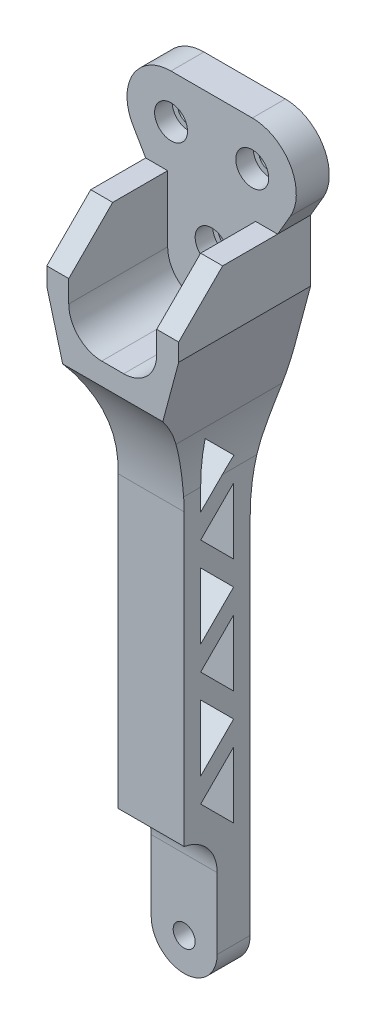
from build123d import *

# Parameters (mm, degrees)
BOSS_EXTRUDE1_DEPTH                     = 40
CUT_EXTRUDE3_REACH                      = 349.563
SKETCH2_W                               = 10
SKETCH2_H                               = 8
FILLET1_RADIUS                          = 15
FILLET1_LENGTH                          = 15
SKETCH3_R                               = 5
CUT_EXTRUDE4_DEPTH                      = 15
CUT_EXTRUDE5_REACH                      = 349.394
CBORE_FOR_M5_HEX_HEAD_BOLT1_D           = 10
CBORE_FOR_M5_HEX_HEAD_BOLT1_CBORE_D     = 15
CBORE_FOR_M5_HEX_HEAD_BOLT1_CBORE_DEPTH = 8
CUT_EXTRUDE6_DEPTH                      = 40


with BuildPart() as part:
    # Sketch1 → Boss-Extrude1 (new, symmetric)
    with BuildSketch(Plane.YZ):
        with BuildLine():
            Line((0, 0), (47.251760651, 0))
            ThreePointArc((47.251760651, 0), (58.870710689, 4.252272915), (65, 15))
            Line((65, 15), (196.846599289, 15))
            ThreePointArc((196.846599289, 15), (222.463976204, 19.510639101), (245, 32.5))
            Line((245, 32.5), (280, 32.5))
            Line((280, 32.5), (300, 12.5))
            Line((300, 12.5), (300, -12.5))
            Line((300, -12.5), (340, -12.5))
            Line((340, -12.5), (340, -27.5))
            Line((340, -27.5), (245, -27.5))
            add(Edge.make_bspline(
                [(179, -15), (212.333333333, -15), (211.666666667, -27.5), (245, -27.5)],
                knots=[0, 0, 0, 0, 1, 1, 1, 1], degree=3))
            Line((179, -15), (0, -15))
            Line((0, -15), (0, 0))
        make_face()
    extrude(amount=BOSS_EXTRUDE1_DEPTH, both=True)

    # Cut-Extrude3: up to this face of the body (flat: up to its plane)
    cut_extrude3_end = Plane(part.part.faces().sort_by_distance((0, 292.5, -27.5))[0])
    # Sketch2 → Cut-Extrude3 (cut, up to the picked face)
    with BuildSketch(Plane.XY.offset(32.5), mode=Mode.PRIVATE) as cut_extrude3_sk1:
        with BuildLine():
            Line((15, 202.853988128), (15, 0))
            Line((15, 0), (40, 0))
            Line((40, 0), (40, 47.251760651))
            Line((40, 47.251760651), (40, 245))
            Line((40, 245), (22.765371804, 245))
            Line((22.765371804, 245), (18.407417371, 228.735892638))
            ThreePointArc((18.407417371, 228.735892638), (15.855513863, 215.90660735), (15, 202.853988128))
        make_face()
    cut_extrude3_tool1 = split(extrude(cut_extrude3_sk1.sketch, amount=-CUT_EXTRUDE3_REACH, mode=Mode.PRIVATE), bisect_by=cut_extrude3_end, keep=Keep.BOTH, mode=Mode.PRIVATE)
    # Sketch2 → Cut-Extrude3 (cut, up to the picked face)
    with BuildSketch(Plane.XY.offset(32.5), mode=Mode.PRIVATE) as cut_extrude3_sk2:
        with BuildLine():
            Line((-40, 0), (-15, 0))
            Line((-15, 0), (-15, 202.853988128))
            ThreePointArc((-15, 202.853988128), (-15.855513863, 215.90660735), (-18.407417371, 228.735892638))
            Line((-18.407417371, 228.735892638), (-22.765371804, 245))
            Line((-22.765371804, 245), (-40, 245))
            Line((-40, 245), (-40, 0))
        make_face()
    cut_extrude3_tool2 = split(extrude(cut_extrude3_sk2.sketch, amount=-CUT_EXTRUDE3_REACH, mode=Mode.PRIVATE), bisect_by=cut_extrude3_end, keep=Keep.BOTH, mode=Mode.PRIVATE)
    # Sketch2 → Cut-Extrude3 (cut, up to the picked face)
    with BuildSketch(Plane.XY.offset(32.5), mode=Mode.PRIVATE) as cut_extrude3_sk3:
        Polygon((30, 272), (22.765371804, 245), (40, 245), (40, 272), align=None)
    cut_extrude3_tool3 = split(extrude(cut_extrude3_sk3.sketch, amount=-CUT_EXTRUDE3_REACH, mode=Mode.PRIVATE), bisect_by=cut_extrude3_end, keep=Keep.BOTH, mode=Mode.PRIVATE)
    # Sketch2 → Cut-Extrude3 (cut, up to the picked face)
    with BuildSketch(Plane.XY.offset(32.5), mode=Mode.PRIVATE) as cut_extrude3_sk4:
        Polygon((-40, 272), (-40, 245), (-22.765371804, 245), (-30, 272), align=None)
    cut_extrude3_tool4 = split(extrude(cut_extrude3_sk4.sketch, amount=-CUT_EXTRUDE3_REACH, mode=Mode.PRIVATE), bisect_by=cut_extrude3_end, keep=Keep.BOTH, mode=Mode.PRIVATE)
    # Sketch2 → Cut-Extrude3 (cut, up to the picked face)
    with BuildSketch(Plane.XY.offset(32.5), mode=Mode.PRIVATE) as cut_extrude3_sk5:
        with BuildLine():
            Line((30, 300), (30, 280))
            Line((30, 280), (40, 280))
            Line((40, 280), (40, 340))
            Line((40, 340), (18.5, 340))
            ThreePointArc((18.5, 340), (35.838126061, 329.969422485), (35.78511038, 309.938938469))
            Line((35.78511038, 309.938938469), (35.773706219, 309.919345885))
            Line((35.773706219, 309.919345885), (30, 300))
        make_face()
    cut_extrude3_tool5 = split(extrude(cut_extrude3_sk5.sketch, amount=-CUT_EXTRUDE3_REACH, mode=Mode.PRIVATE), bisect_by=cut_extrude3_end, keep=Keep.BOTH, mode=Mode.PRIVATE)
    # Sketch2 → Cut-Extrude3 (cut, up to the picked face)
    with BuildSketch(Plane.XY.offset(32.5), mode=Mode.PRIVATE) as cut_extrude3_sk6:
        with Locations((35, 276)):
            Rectangle(SKETCH2_W, SKETCH2_H)
    cut_extrude3_tool6 = split(extrude(cut_extrude3_sk6.sketch, amount=-CUT_EXTRUDE3_REACH, mode=Mode.PRIVATE), bisect_by=cut_extrude3_end, keep=Keep.BOTH, mode=Mode.PRIVATE)
    # Sketch2 → Cut-Extrude3 (cut, up to the picked face)
    with BuildSketch(Plane.XY.offset(32.5), mode=Mode.PRIVATE) as cut_extrude3_sk7:
        with Locations((-35, 276)):
            Rectangle(SKETCH2_W, SKETCH2_H)
    cut_extrude3_tool7 = split(extrude(cut_extrude3_sk7.sketch, amount=-CUT_EXTRUDE3_REACH, mode=Mode.PRIVATE), bisect_by=cut_extrude3_end, keep=Keep.BOTH, mode=Mode.PRIVATE)
    # Sketch2 → Cut-Extrude3 (cut, up to the picked face)
    with BuildSketch(Plane.XY.offset(32.5), mode=Mode.PRIVATE) as cut_extrude3_sk8:
        with BuildLine():
            Line((-40, 340), (-40, 280))
            Line((-40, 280), (-30, 280))
            Line((-30, 280), (-30, 300))
            Line((-30, 300), (-35.773706219, 309.919345885))
            Line((-35.773706219, 309.919345885), (-35.78511038, 309.938938469))
            ThreePointArc((-35.78511038, 309.938938469), (-35.838126061, 329.969422485), (-18.5, 340))
            Line((-18.5, 340), (-40, 340))
        make_face()
    cut_extrude3_tool8 = split(extrude(cut_extrude3_sk8.sketch, amount=-CUT_EXTRUDE3_REACH, mode=Mode.PRIVATE), bisect_by=cut_extrude3_end, keep=Keep.BOTH, mode=Mode.PRIVATE)
    add(cut_extrude3_tool1.solids().sort_by(Axis((27.70054, 120.268436, 32.5), (0, 0, -1)))[0], mode=Mode.SUBTRACT)
    add(cut_extrude3_tool2.solids().sort_by(Axis((-27.70054, 120.268436, 32.5), (0, 0, -1)))[0], mode=Mode.SUBTRACT)
    add(cut_extrude3_tool3.solids().sort_by(Axis((33.031192, 257.304616, 32.5), (0, 0, -1)))[0], mode=Mode.SUBTRACT)
    add(cut_extrude3_tool4.solids().sort_by(Axis((-33.031192, 257.304616, 32.5), (0, 0, -1)))[0], mode=Mode.SUBTRACT)
    add(cut_extrude3_tool5.solids().sort_by(Axis((35.537859, 306.308968, 32.5), (0, 0, -1)))[0], mode=Mode.SUBTRACT)
    add(cut_extrude3_tool6.solids().sort_by(Axis((35, 276, 32.5), (0, 0, -1)))[0], mode=Mode.SUBTRACT)
    add(cut_extrude3_tool7.solids().sort_by(Axis((-35, 276, 32.5), (0, 0, -1)))[0], mode=Mode.SUBTRACT)
    add(cut_extrude3_tool8.solids().sort_by(Axis((-35.537859, 306.308968, 32.5), (0, 0, -1)))[0], mode=Mode.SUBTRACT)

    # Fillet1: full round fillet: the end face becomes a half cylinder, R = half its width
    fillet1_face = Plane((0, 0, -7.5), x_dir=(0, 0, -1), z_dir=(0, -1, 0))  # on the end face: x along it, z out of the body
    fillet1_slab = fillet1_face.offset(-FILLET1_RADIUS / 2) * Box(FILLET1_LENGTH, 2 * FILLET1_RADIUS, FILLET1_RADIUS, mode=Mode.PRIVATE)  # the body's end, R deep
    fillet1_round = Plane((0, 15, -7.5), x_dir=(0, -1, 0), z_dir=(0, 0, -1)) * Cylinder(FILLET1_RADIUS, FILLET1_LENGTH, mode=Mode.PRIVATE)  # its axis R under the face
    add(fillet1_slab - fillet1_round, mode=Mode.SUBTRACT)

    # Sketch3 → Cut-Extrude4 (cut)
    with BuildSketch(Plane.XY):
        with Locations((0, 15)):
            Circle(SKETCH3_R)
    extrude(amount=-CUT_EXTRUDE4_DEPTH, mode=Mode.SUBTRACT)

    # Cut-Extrude5: up to this face of the body (flat: up to its plane)
    cut_extrude5_end = Plane(part.part.faces().sort_by_distance((0, 319.72582268, -12.5))[0])
    # Sketch4 → Cut-Extrude5 (cut, up to the picked face)
    with BuildSketch(Plane.XY.offset(32.5), mode=Mode.PRIVATE) as cut_extrude5_sk1:
        with BuildLine():
            Line((-20, 300), (-20, 270))
            ThreePointArc((-20, 270), (-15.606601718, 259.393398282), (-5, 255))
            Line((-5, 255), (5, 255))
            ThreePointArc((5, 255), (15.606601718, 259.393398282), (20, 270))
            Line((20, 270), (20, 300))
            Line((20, 300), (-20, 300))
        make_face()
    cut_extrude5_tool1 = split(extrude(cut_extrude5_sk1.sketch, amount=-CUT_EXTRUDE5_REACH, mode=Mode.PRIVATE), bisect_by=cut_extrude5_end, keep=Keep.BOTH, mode=Mode.PRIVATE)
    add(cut_extrude5_tool1.solids().sort_by(Axis((0, 278.585623, 32.5), (0, 0, -1)))[0], mode=Mode.SUBTRACT)

    # CBORE for M5 Hex Head Bolt1 (through all)
    with Locations(Plane.XY.offset(-12.5)):
        with Locations((-18.46, 320), (18.46, 320), (0, 280)):
            CounterBoreHole(CBORE_FOR_M5_HEX_HEAD_BOLT1_D / 2, CBORE_FOR_M5_HEX_HEAD_BOLT1_CBORE_D / 2, CBORE_FOR_M5_HEX_HEAD_BOLT1_CBORE_DEPTH)

    # Sketch8 → Cut-Extrude6 (cut, symmetric)
    with BuildSketch(Plane.YZ.offset(15)):
        Polygon((63, -7.5), (93, -7.5), (78, 7.5), align=None)
        Polygon((89, 7.5), (119, 7.5), (104, -7.5), align=None)
        Polygon((115, -7.5), (145, -7.5), (130, 7.5), align=None)
        Polygon((156, -7.5), (141, 7.5), (171, 7.5), align=None)
        Polygon((167, -7.5), (197, -7.5), (182, 7.5), align=None)
        Polygon((208, -7.5), (193, 7.5), (223, 7.5), align=None)
    extrude(amount=CUT_EXTRUDE6_DEPTH, both=True, mode=Mode.SUBTRACT)


solid = part.part
